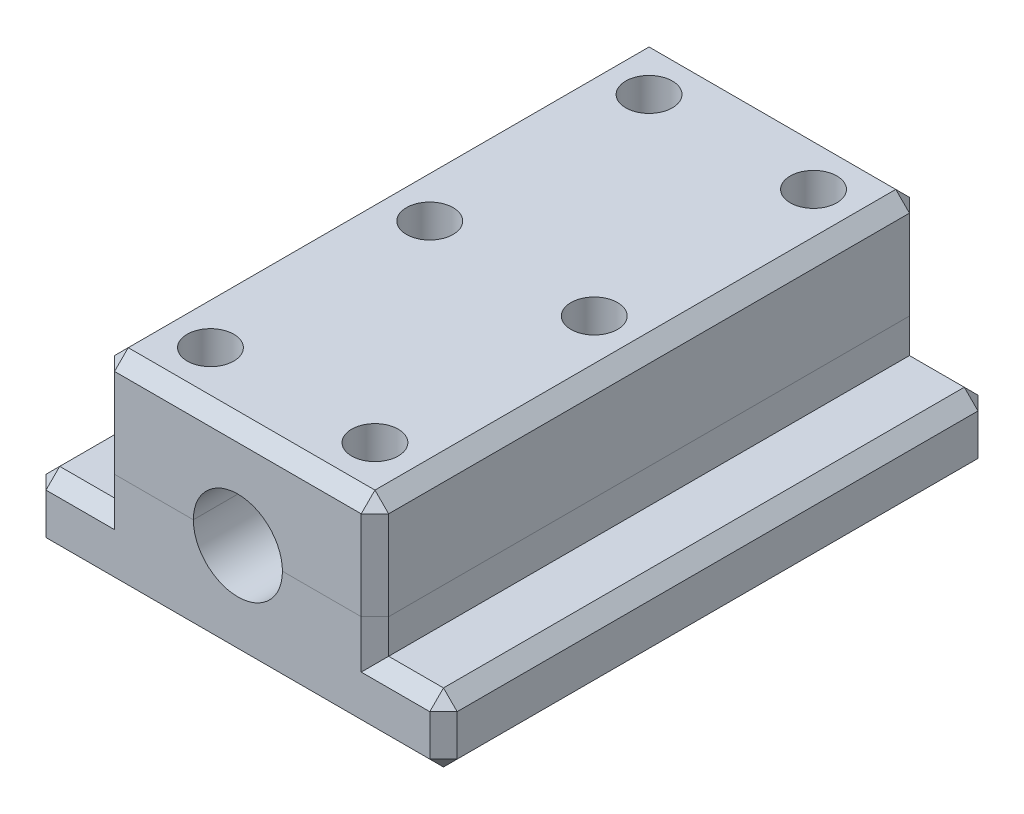
from build123d import *

# Parameters (mm, degrees)
SKETCH1_W            = 20
SKETCH1_H            = 15
SKETCH1_R            = 3.25
BOSS_EXTRUDE1_DEPTH  = 40
M3_CLEARANCE_HOLE1_D = 3.4
LPATTERN1_COUNT      = 3
LPATTERN1_PITCH      = 16
LPATTERN1_COUNT_DIR2 = 2
LPATTERN1_PITCH_DIR2 = 12
SKETCH5_W            = 5
SKETCH5_H            = 5
BOSS_EXTRUDE3_DEPTH  = 40
CHAMFER1_SIZE        = 1


with BuildPart() as part:
    # Sketch1 → Boss-Extrude1 (new body)
    with BuildSketch(Plane.XY):
        Rectangle(SKETCH1_W, SKETCH1_H)
        Circle(SKETCH1_R, mode=Mode.SUBTRACT)
    extrude(amount=BOSS_EXTRUDE1_DEPTH)

    # M3 Clearance Hole1 (through all)
    with Locations(Plane(origin=(0, 7.5, 0), x_dir=(1, 0, 0), z_dir=(0, 1, 0))):
        with Locations((-6, -36)):
            m3_clearance_hole1 = Hole(M3_CLEARANCE_HOLE1_D / 2)

    # LPattern1: M3 Clearance Hole1 3 × 2
    with Locations(*[(j * LPATTERN1_PITCH_DIR2, 0, -i * LPATTERN1_PITCH) for i in range(LPATTERN1_COUNT) for j in range(LPATTERN1_COUNT_DIR2) if (i, j) != (0, 0)]):
        add(m3_clearance_hole1, mode=Mode.SUBTRACT)

    # Sketch5 → Boss-Extrude3 (add)
    with BuildSketch(Plane.XY.offset(40)):
        with Locations((12.5, -5)):
            Rectangle(SKETCH5_W, SKETCH5_H)
    boss_extrude3 = extrude(amount=-BOSS_EXTRUDE3_DEPTH)

    # Mirror2: Boss-Extrude3 across plane
    add(boss_extrude3.mirror(Plane(origin=(0, 0, 0), x_dir=(0, 0, 1), z_dir=(1, 0, 0))))

    # Chamfer1
    chamfer1_edges = [part.edges().sort_by_distance(p)[0] for p in [
        (-10, 2.5, 40),
        (0, -7.5, 40),
        (0, -7.5, 0),
        (10, 2.5, 0),
        (10, 2.5, 40),
        (15, -2.5, 20),
        (15, -7.5, 20),
        (15, -5, 40),
        (-10, 2.5, 0),
        (12.5, -2.5, 40),
        (12.5, -2.5, 0),
        (15, -5, 0),
        (0, 7.5, 0),
        (-12.5, -2.5, 0),
        (-15, -2.5, 20),
        (-12.5, -2.5, 40),
        (-15, -5, 0),
        (-15, -7.5, 20),
        (-15, -5, 40),
        (-10, 7.5, 20),
        (10, 7.5, 20),
        (0, 7.5, 40),
    ]]
    chamfer(chamfer1_edges, length=CHAMFER1_SIZE)


with BuildPart() as body_2:
    # Split1: the piece on the far side of the plane
    add(part.part)
    split(bisect_by=Plane.ZX, keep=Keep.BOTTOM)


with BuildPart() as part_1:
    add(part.part)

    # Split1
    split(bisect_by=Plane.ZX, keep=Keep.TOP)


solid = Compound([body_2.part, part_1.part])
